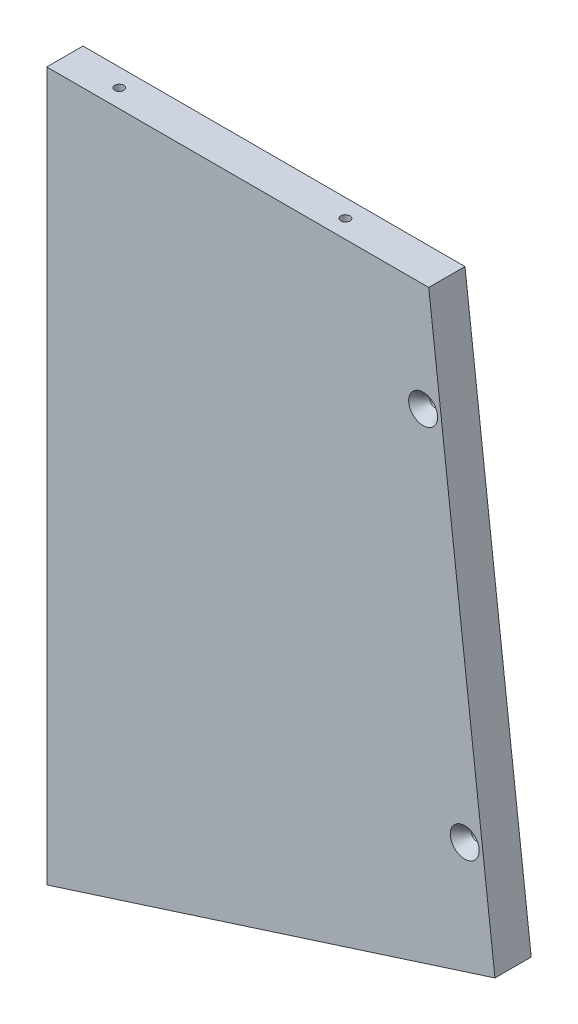
from build123d import *

# Parameters (mm, degrees)
BOSS_EXTRUDE1_DEPTH = 12.7
HOLE3_D             = 3.175
HOLE3_DEPTH         = 31.75
HOLE3_CSINK_D       = 10.16
HOLE3_CSINK_ANGLE   = 82
HOLE3_TIP           = 0.953866233
HOLE6_D             = 3.175
HOLE6_DEPTH         = 38.1
HOLE6_CSINK_D       = 10.16
HOLE6_CSINK_ANGLE   = 82
HOLE6_TIP           = 0.953866233
HOLE7_D             = 3.175
HOLE7_DEPTH         = 31.75
HOLE7_CSINK_D       = 10.16
HOLE7_CSINK_ANGLE   = 82
HOLE7_TIP           = 0.953866233
HOLE8_D             = 3.175
HOLE8_DEPTH         = 31.75
HOLE8_CSINK_D       = 10.16
HOLE8_CSINK_ANGLE   = 82
HOLE8_TIP           = 0.953866233


with BuildPart() as part:
    # Sketch1 → Boss-Extrude1 (new body)
    with BuildSketch(Plane.XY):
        Polygon((-88.190159952, 0), (-222.052967181, 0), (-222.052967181, -248.25), (-64.977416983, -197.966048293), align=None)
    extrude(amount=-BOSS_EXTRUDE1_DEPTH)

    # Hole3
    with Locations(Plane(origin=(-234.752967181, 1090.512770338, -135.816741379), x_dir=(0, 0, -1), z_dir=(-1, 0, 0))):
        with Locations((-129.466741379, 1300.662770337), (-129.466741379, 1128.612770337), (129.198788767, 1128.612770337), (129.198788767, 1300.662770337)):
            CounterSinkHole(HOLE3_D / 2, HOLE3_CSINK_D / 2, depth=HOLE3_DEPTH, counter_sink_angle=HOLE3_CSINK_ANGLE)
            with Locations((0, 0, -(HOLE3_DEPTH + HOLE3_TIP / 2))):  # 118° drill point
                Cone(0, HOLE3_D / 2, HOLE3_TIP, mode=Mode.SUBTRACT)

    # Hole6
    with Locations(Plane(origin=(181.039434513, 1090.512770338, 0), x_dir=(-0.9271838545667885, -0.3746065934159093, 0), z_dir=(0, 0, 1))):
        with Locations((707.166557203, 1065.270372796), (674.127983646, 944.603090451)):
            CounterSinkHole(HOLE6_D / 2, HOLE6_CSINK_D / 2, depth=HOLE6_DEPTH, counter_sink_angle=HOLE6_CSINK_ANGLE)
            with Locations((0, 0, -(HOLE6_DEPTH + HOLE6_TIP / 2))):  # 118° drill point
                Cone(0, HOLE6_D / 2, HOLE6_TIP, mode=Mode.SUBTRACT)

    # Hole7
    with Locations(Plane(origin=(181.039434513, 12.7, -135.816741379), x_dir=(0, 0, -1), z_dir=(0, 1, 0))):
        with Locations((129.198788767, 384.042401694), (-129.466741379, 384.042401694), (-129.466741379, 304.786761906), (-110.416741379, 409.442401694), (-0.133976306, 409.442401694), (110.148788767, 409.442401694), (129.198788767, 304.786761906)):
            CounterSinkHole(HOLE7_D / 2, HOLE7_CSINK_D / 2, depth=HOLE7_DEPTH, counter_sink_angle=HOLE7_CSINK_ANGLE)
            with Locations((0, 0, -(HOLE7_DEPTH + HOLE7_TIP / 2))):  # 118° drill point
                Cone(0, HOLE7_D / 2, HOLE7_TIP, mode=Mode.SUBTRACT)

    # Hole8
    with Locations(Plane(origin=(536.177050645, -18.855816567, -135.816741379), x_dir=(0, 0, 1), z_dir=(0.3048844921716131, -0.9523893355310409, 0))):
        with Locations((-129.257383629, 766.263727577), (129.466741379, 668.242950575), (129.466741379, 766.064256541), (-129.408220012, 668.442537903)):
            CounterSinkHole(HOLE8_D / 2, HOLE8_CSINK_D / 2, depth=HOLE8_DEPTH, counter_sink_angle=HOLE8_CSINK_ANGLE)
            with Locations((0, 0, -(HOLE8_DEPTH + HOLE8_TIP / 2))):  # 118° drill point
                Cone(0, HOLE8_D / 2, HOLE8_TIP, mode=Mode.SUBTRACT)


solid = part.part
